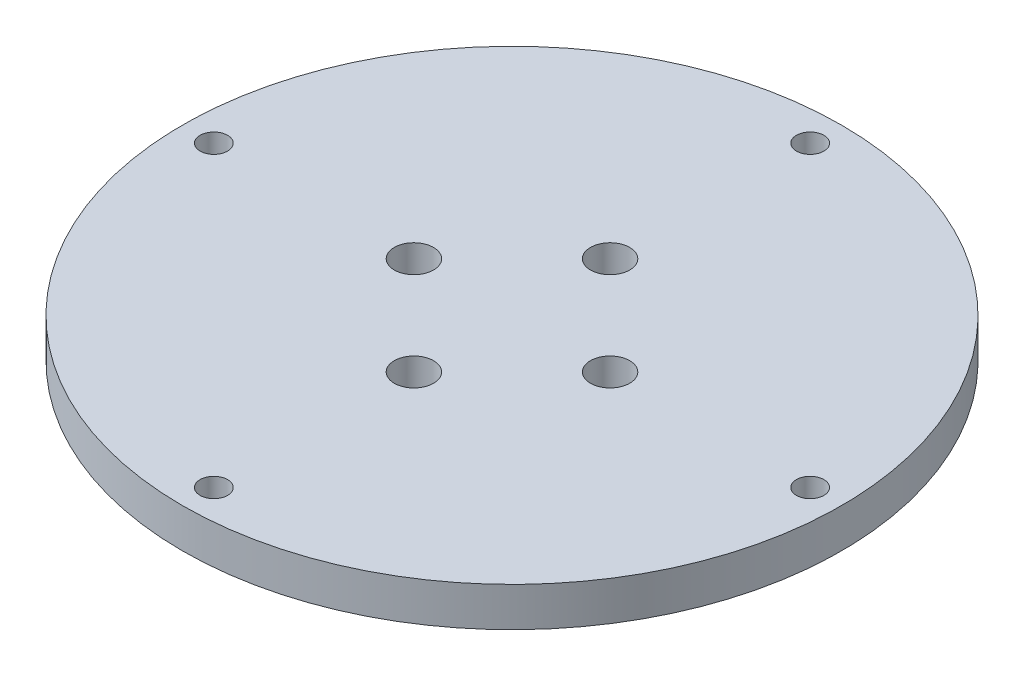
from build123d import *

# Parameters (mm, degrees)
SKETCH1_R            = 84
BOSS_EXTRUDE1_DEPTH  = 10
M6_CLEARANCE_HOLE1_D = 7
SKETCH4_R            = 5
CUT_EXTRUDE1_DEPTH   = 10


with BuildPart() as part:
    # Sketch1 → Boss-Extrude1 (new body)
    with BuildSketch(Plane(origin=(0, 0, 0), x_dir=(1, 0, 0), z_dir=(0, 1, 0))):
        with Locations(Location((0, 0, 0), (0, 0, 270))):
            Circle(SKETCH1_R)
    extrude(amount=BOSS_EXTRUDE1_DEPTH)

    # M6 Clearance Hole1 (through all)
    with Locations(Plane(origin=(0, 10, -76), x_dir=(0, 0, 1), z_dir=(0, 1, 0))):
        with Locations((0, 0), (76, -76), (152, 0), (76, 76)):
            Hole(M6_CLEARANCE_HOLE1_D / 2)

    # Sketch4 → Cut-Extrude1 (cut)
    with BuildSketch(Plane(origin=(0, 10, 0), x_dir=(1, 0, 0), z_dir=(0, 1, 0))):
        with Locations(Location((0, 25, 0), (0, 0, 270))):
            Circle(SKETCH4_R)
        with Locations(Location((25, 0, 0), (0, 0, 270))):
            Circle(SKETCH4_R)
        with Locations(Location((-25, 0, 0), (0, 0, 270))):
            Circle(SKETCH4_R)
        with Locations(Location((0, -25, 0), (0, 0, 270))):
            Circle(SKETCH4_R)
    extrude(amount=-CUT_EXTRUDE1_DEPTH, mode=Mode.SUBTRACT)


solid = part.part
